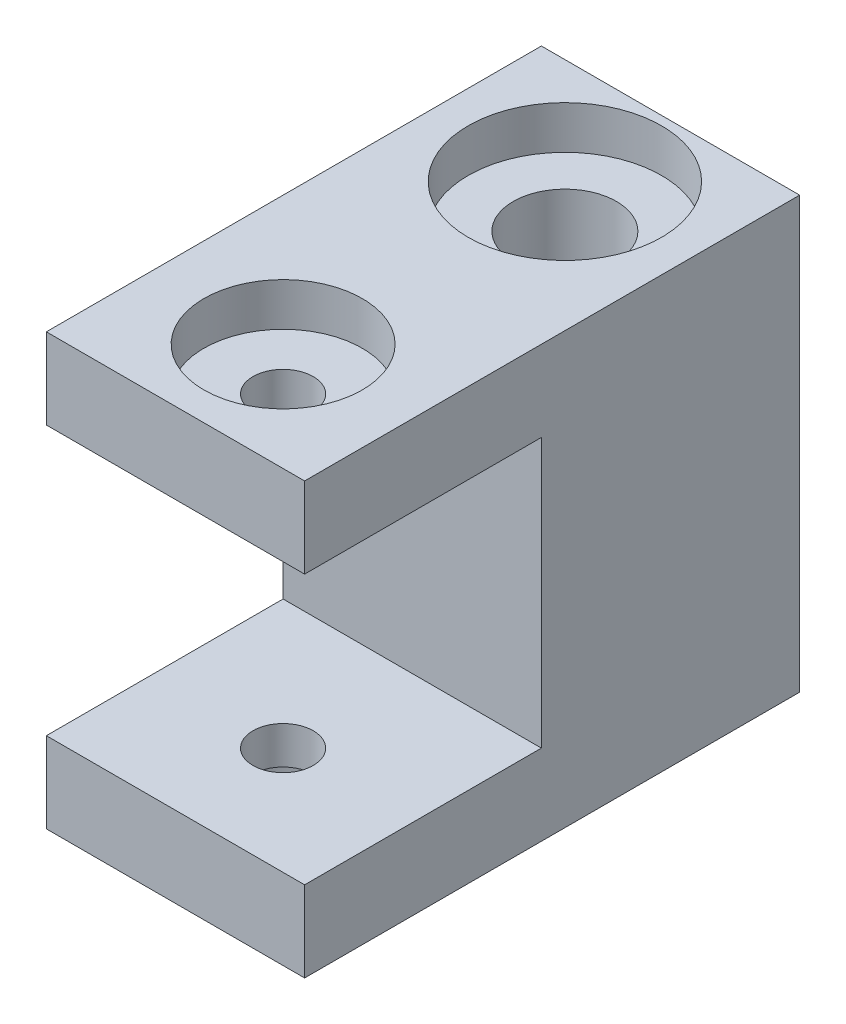
from build123d import *

# Parameters (mm, degrees)
SKETCH1_W           = 38.1
SKETCH1_H           = 63.5
BOSS_EXTRUDE1_DEPTH = 36.5125
SKETCH2_W           = 34.925
SKETCH2_H           = 39.6875
CUT_EXTRUDE1_DEPTH  = 62.585998054
SKETCH3_R           = 4.445
CUT_EXTRUDE2_DEPTH  = 76.685633751
SKETCH4_R           = 11.684
CUT_EXTRUDE3_DEPTH  = 6.35
SKETCH6_R           = 14.2621
CUT_EXTRUDE5_DEPTH  = 6.35
SKETCH7_R           = 7.62
CUT_EXTRUDE6_DEPTH  = 71.44279705


with BuildPart() as part:
    # Sketch1 → Boss-Extrude1 (new, symmetric)
    with BuildSketch(Plane.XY):
        Rectangle(SKETCH1_W, SKETCH1_H)
    extrude(amount=BOSS_EXTRUDE1_DEPTH, both=True)

    # Sketch2 → Cut-Extrude1 (cut, through all)
    with BuildSketch(Plane(origin=(19.05, 0, 0), x_dir=(0, 0, -1), z_dir=(1, 0, 0))):
        with Locations((-19.05, 0)):
            Rectangle(SKETCH2_W, SKETCH2_H)
    extrude(amount=-CUT_EXTRUDE1_DEPTH, mode=Mode.SUBTRACT)

    # Sketch3 → Cut-Extrude2 (cut, through all)
    with BuildSketch(Plane(origin=(0, 31.75, 0), x_dir=(1, 0, 0), z_dir=(0, 1, 0))):
        with Locations(Location((0, -20.6375, 0), (0, 0, 270))):
            Circle(SKETCH3_R)
    extrude(amount=-CUT_EXTRUDE2_DEPTH, mode=Mode.SUBTRACT)

    # Sketch4 → Cut-Extrude3 (cut)
    with BuildSketch(Plane(origin=(0, 31.75, 0), x_dir=(1, 0, 0), z_dir=(0, 1, 0))):
        with Locations(Location((0, -20.6375, 0), (0, 0, 270))):
            Circle(SKETCH4_R)
    cut_extrude3 = extrude(amount=-CUT_EXTRUDE3_DEPTH, mode=Mode.SUBTRACT)

    # Sketch6 → Cut-Extrude5 (cut)
    with BuildSketch(Plane(origin=(0, 31.75, 0), x_dir=(1, 0, 0), z_dir=(0, 1, 0))):
        with Locations(Location((0, 20.9296, 0), (0, 0, 270))):
            Circle(SKETCH6_R)
    cut_extrude5 = extrude(amount=-CUT_EXTRUDE5_DEPTH, mode=Mode.SUBTRACT)

    # Mirror1: Cut-Extrude3, Cut-Extrude5 across plane
    add(cut_extrude3.mirror(Plane.ZX), mode=Mode.SUBTRACT)
    add(cut_extrude5.mirror(Plane.ZX), mode=Mode.SUBTRACT)

    # Sketch7 → Cut-Extrude6 (cut, through all)
    with BuildSketch(Plane(origin=(0, 25.4, 0), x_dir=(1, 0, 0), z_dir=(0, 1, 0))):
        with Locations(Location((0, 20.9296, 0), (0, 0, 270))):
            Circle(SKETCH7_R)
    extrude(amount=-CUT_EXTRUDE6_DEPTH, mode=Mode.SUBTRACT)


solid = part.part
